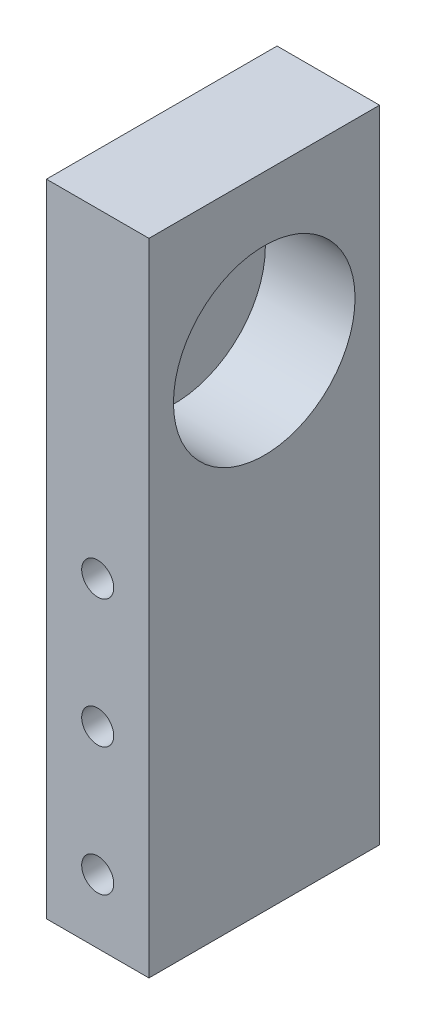
from build123d import *

# Parameters (mm, degrees)
SKETCH1_W           = 20.32
SKETCH1_H           = 76.2
BOSS_EXTRUDE1_DEPTH = 22.86
SKETCH2_R           = 3.175
CUT_EXTRUDE1_DEPTH  = 92.1573409
SKETCH3_W           = 20.32
SKETCH3_H           = 45.72
BOSS_EXTRUDE2_DEPTH = 50.8
SKETCH4_R           = 17.999964
CUT_EXTRUDE2_DEPTH  = 17.78
SKETCH5_R           = 2.999994
CUT_EXTRUDE3_DEPTH  = 131.260155074


with BuildPart() as part:
    # Sketch1 → Boss-Extrude1 (new, symmetric)
    with BuildSketch(Plane.XY):
        with Locations((10.16, 38.1)):
            Rectangle(SKETCH1_W, SKETCH1_H)
    extrude(amount=BOSS_EXTRUDE1_DEPTH, both=True)

    # Sketch2 → Cut-Extrude1 (cut, through all)
    with BuildSketch(Plane.XY.offset(22.86)):
        with Locations((10.16, 12.7)):
            Circle(SKETCH2_R)
        with Locations((10.16, 38.1)):
            Circle(SKETCH2_R)
        with Locations((10.16, 63.5)):
            Circle(SKETCH2_R)
    extrude(amount=-CUT_EXTRUDE1_DEPTH, mode=Mode.SUBTRACT)

    # Sketch3 → Boss-Extrude2 (add)
    with BuildSketch(Plane(origin=(0, 76.2, 0), x_dir=(1, 0, 0), z_dir=(0, 1, 0))):
        with Locations((10.16, 0)):
            Rectangle(SKETCH3_W, SKETCH3_H)
    extrude(amount=BOSS_EXTRUDE2_DEPTH)

    # Sketch4 → Cut-Extrude2 (cut)
    with BuildSketch(Plane(origin=(20.32, 0, 0), x_dir=(0, 0, -1), z_dir=(1, 0, 0))):
        with Locations((0, 96.300036)):
            Circle(SKETCH4_R)
    extrude(amount=-CUT_EXTRUDE2_DEPTH, mode=Mode.SUBTRACT)

    # Sketch5 → Cut-Extrude3 (cut, through all)
    with BuildSketch(Plane(origin=(2.54, 0, 0), x_dir=(0, 0, -1), z_dir=(1, 0, 0))):
        with Locations((0, 96.300036)):
            Circle(SKETCH5_R)
    extrude(amount=-CUT_EXTRUDE3_DEPTH, mode=Mode.SUBTRACT)


solid = part.part
